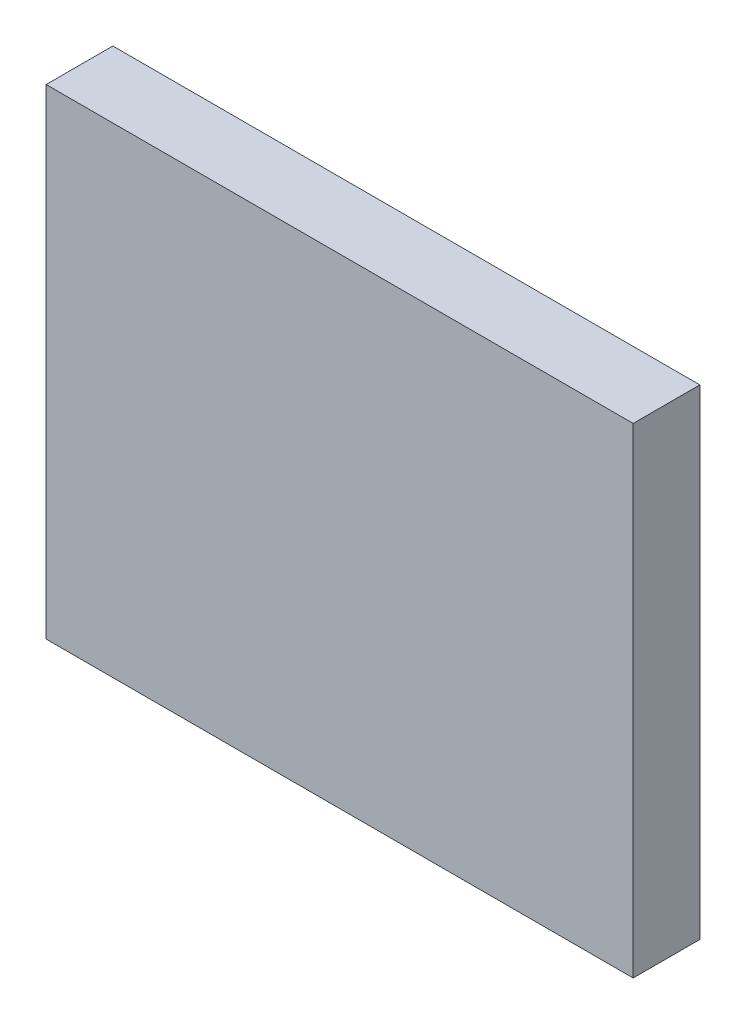
from build123d import *

# Parameters (mm, degrees)
SKETCH_1_W      = 88
SKETCH_1_H      = 72
EXTRUDE_1_DEPTH = 10


with BuildPart() as part:
    # 草图1 → 凸台-拉伸1 (new body)
    with BuildSketch(Plane.XY):
        with Locations((44, 36)):
            Rectangle(SKETCH_1_W, SKETCH_1_H)
    extrude(amount=EXTRUDE_1_DEPTH)


solid = part.part
